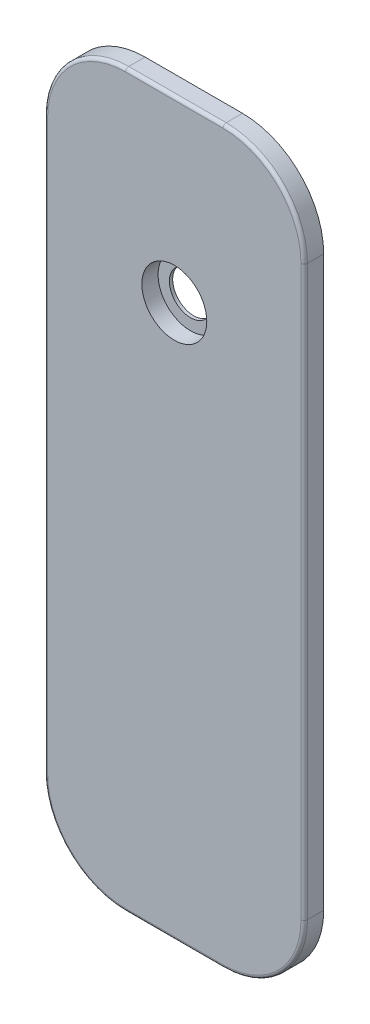
from build123d import *

# Parameters (mm, degrees)
SKETCH_1_R          = 6.5
EXTRUDE_1_DEPTH     = 6
FILLET_1_R          = 1
SKETCH_2_R          = 10
CUT_EXTRUDE_1_DEPTH = 5


with BuildPart() as part:
    # 草图1 → 凸台-拉伸1 (new body)
    with BuildSketch(Plane.XY):
        with BuildLine():
            Line((15, 112.5), (-15, 112.5))
            ThreePointArc((-15, 112.5), (-32.67766953, 105.17766953), (-40, 87.5))
            Line((-40, 87.5), (-40, -87.5))
            ThreePointArc((-40, -87.5), (-32.67766953, -105.17766953), (-15, -112.5))
            Line((-15, -112.5), (15, -112.5))
            ThreePointArc((15, -112.5), (32.67766953, -105.17766953), (40, -87.5))
            Line((40, -87.5), (40, 87.5))
            ThreePointArc((40, 87.5), (32.67766953, 105.17766953), (15, 112.5))
        make_face()
        with Locations((0, 57.5)):
            Circle(SKETCH_1_R, mode=Mode.SUBTRACT)
    extrude(amount=EXTRUDE_1_DEPTH)

    # 圆角1
    fillet_1_edges = [part.edges().sort_by_distance(p)[0] for p in [
        (32.67766953, -105.17766953, 6),
        (40, 0, 6),
        (32.67766953, 105.17766953, 6),
        (0, 112.5, 6),
        (-32.67766953, 105.17766953, 6),
        (-40, 0, 6),
        (-32.67766953, -105.17766953, 6),
        (0, -112.5, 6),
    ]]
    fillet(fillet_1_edges, radius=FILLET_1_R)

    # 草图2 → 切除-拉伸1 (cut)
    with BuildSketch(Plane.XY.offset(6)):
        with Locations((0, 57.5)):
            Circle(SKETCH_2_R)
    extrude(amount=-CUT_EXTRUDE_1_DEPTH, mode=Mode.SUBTRACT)


solid = part.part
